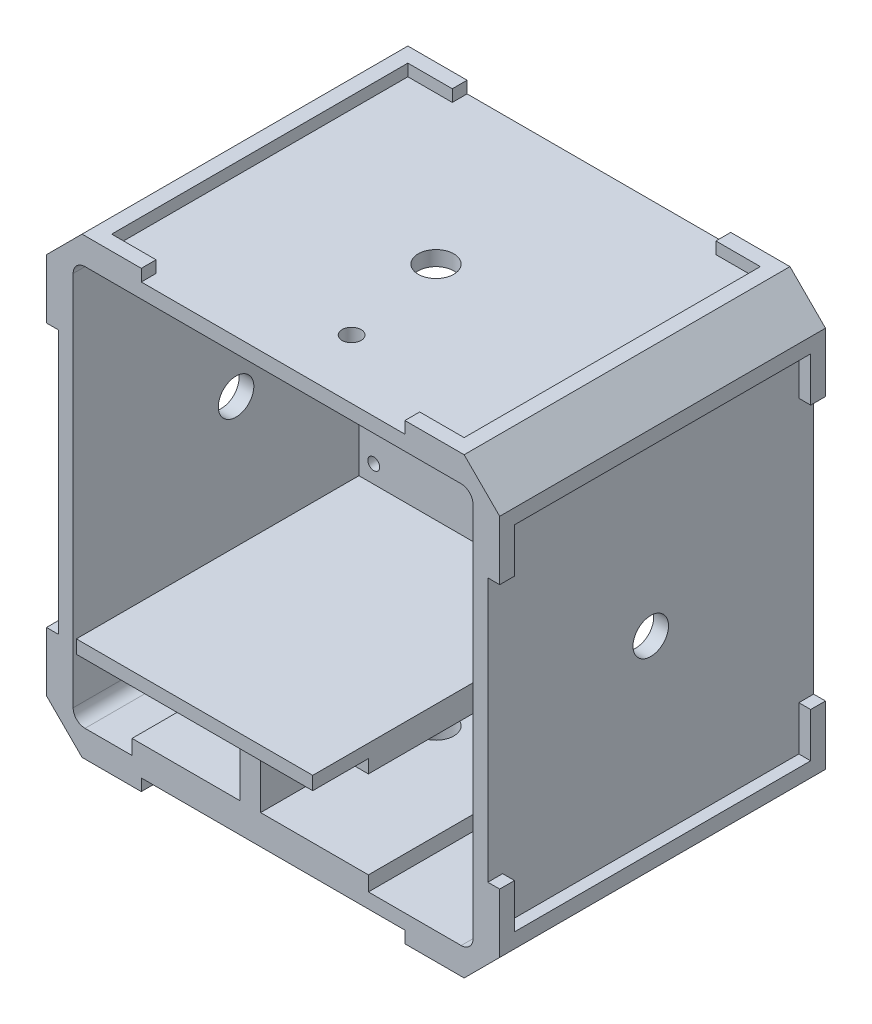
from build123d import *

# Parameters (mm, degrees)
BOSS_EXTRUDE1_DEPTH            = 55
SKETCH2_W                      = 67.5
SKETCH2_H                      = 67.5
BOSS_EXTRUDE2_DEPTH            = 2.5
CUT_EXTRUDE1_REACH             = 75.378
SKETCH3_W                      = 16.5
SKETCH3_H                      = 7
SKETCH3_W_2                    = 8
SKETCH3_H_2                    = 16
FILLET1_R                      = 1
CUT_EXTRUDE2_REACH             = 77.187
SKETCH4_R                      = 1.5
MIRROR2_COPY_1_REACH           = 77.187
MIRROR2_COPY_1_SKETCH_R        = 1.5
BOSS_EXTRUDE3_DEPTH            = 16.09
BOSS_EXTRUDE3_DEPTH_BACK       = 23.81
BOSS_EXTRUDE4_DEPTH            = 47
SKETCH7_W                      = 39.9
SKETCH7_H                      = 19.5
CUT_EXTRUDE3_DEPTH             = 9.4
BOSS_EXTRUDE7_DEPTH            = 2
CUT_EXTRUDE6_REACH             = 85.213
CUT_EXTRUDE6_DIRECTION_2_DEPTH = 84.213490493
CUT_EXTRUDE8_DEPTH             = 104.526192338
CUT_EXTRUDE8_DEPTH_BACK        = 2.5
SKETCH15_R                     = 1.6
SKETCH16_W                     = 7.5
SKETCH16_H                     = 2.5
BOSS_EXTRUDE8_DEPTH            = 7
CUT_EXTRUDE9_REACH             = 74.438
SKETCH17_R                     = 1
SKETCH19_R                     = 3
CUT_EXTRUDE10_DEPTH            = 2.5
BOSS_EXTRUDE9_DEPTH            = 2
CIRPATTERN1_COUNT              = 4
CIRPATTERN2_COUNT              = 4
CUT_EXTRUDE11_DEPTH            = 2.5
BOSS_EXTRUDE12_DEPTH           = 55
CUT_EXTRUDE12_REACH            = 75.459
SKETCH23_W                     = 5.5
SKETCH23_H                     = 16
BOSS_EXTRUDE13_REACH           = 94.538
FILLET2_R                      = 1.5


with BuildPart() as part:
    # Sketch1 → Boss-Extrude1 (new body)
    with BuildSketch(Plane.XY):
        with BuildLine():
            Line((-36.25, 32.25), (-36.25, -32.25))
            ThreePointArc((-36.25, -32.25), (-35.078427125, -35.078427125), (-32.25, -36.25))
            Line((-32.25, -36.25), (32.25, -36.25))
            ThreePointArc((32.25, -36.25), (35.078427125, -35.078427125), (36.25, -32.25))
            Line((36.25, -32.25), (36.25, 32.25))
            ThreePointArc((36.25, 32.25), (35.078427125, 35.078427125), (32.25, 36.25))
            Line((32.25, 36.25), (-32.25, 36.25))
            ThreePointArc((-32.25, 36.25), (-35.078427125, 35.078427125), (-36.25, 32.25))
        make_face()
        with BuildLine():
            Line((-31.75, 33.75), (31.75, 33.75))
            ThreePointArc((31.75, 33.75), (33.164213562, 33.164213562), (33.75, 31.75))
            Line((33.75, 31.75), (33.75, -31.75))
            ThreePointArc((33.75, -31.75), (33.164213562, -33.164213562), (31.75, -33.75))
            Line((31.75, -33.75), (-31.75, -33.75))
            ThreePointArc((-31.75, -33.75), (-33.164213562, -33.164213562), (-33.75, -31.75))
            Line((-33.75, -31.75), (-33.75, 31.75))
            ThreePointArc((-33.75, 31.75), (-33.164213562, 33.164213562), (-31.75, 33.75))
        make_face(mode=Mode.SUBTRACT)
    extrude(amount=BOSS_EXTRUDE1_DEPTH)

    # Sketch2 → Boss-Extrude2 (add)
    with BuildSketch(Plane.XY):
        Rectangle(SKETCH2_W, SKETCH2_H)
    extrude(amount=BOSS_EXTRUDE2_DEPTH)

    # Sketch3 → Cut-Extrude1 (cut, up to next)
    with BuildSketch(Plane.XY.offset(2.5), mode=Mode.PRIVATE) as cut_extrude1_sk1:
        with Locations((-11.63, 14.79)):
            Rectangle(SKETCH3_W, SKETCH3_H)
    cut_extrude1_tool1 = extrude(cut_extrude1_sk1.sketch, amount=-CUT_EXTRUDE1_REACH, mode=Mode.PRIVATE) & part.part
    # Sketch3 → Cut-Extrude1 (cut, up to next)
    with BuildSketch(Plane.XY.offset(2.5), mode=Mode.PRIVATE) as cut_extrude1_sk2:
        Rectangle(SKETCH3_W_2, SKETCH3_H_2)
    cut_extrude1_tool2 = extrude(cut_extrude1_sk2.sketch, amount=-CUT_EXTRUDE1_REACH, mode=Mode.PRIVATE) & part.part
    add(cut_extrude1_tool1.solids().sort_by_distance((-11.63, 14.79, 2.5))[0], mode=Mode.SUBTRACT)
    add(cut_extrude1_tool2.solids().sort_by_distance((0, 0, 2.5))[0], mode=Mode.SUBTRACT)

    # Fillet1
    fillet1_edges = [part.edges().sort_by_distance(p)[0] for p in [
        (-19.88, 11.29, 1.25),
        (-19.88, 18.29, 1.25),
        (-3.38, 18.29, 1.25),
        (-3.38, 11.29, 1.25),
        (4, -8, 1.25),
        (-4, -8, 1.25),
        (-4, 8, 1.25),
        (4, 8, 1.25),
    ]]
    fillet(fillet1_edges, radius=FILLET1_R)

    # Sketch4 → Cut-Extrude2 (cut, up to next)
    with BuildSketch(Plane(origin=(0, 0, 0), x_dir=(-1, 0, 0), z_dir=(0, 0, -1)), mode=Mode.PRIVATE) as cut_extrude2_sk1:
        with Locations((-28.75, 28.75)):
            Circle(SKETCH4_R)
    cut_extrude2_tool1 = extrude(cut_extrude2_sk1.sketch, amount=-CUT_EXTRUDE2_REACH, mode=Mode.PRIVATE) & part.part
    cut_extrude2 = cut_extrude2_tool1.solids().sort_by_distance((28.75, 28.75, 0))[0]
    add(cut_extrude2, mode=Mode.SUBTRACT)

    # Mirror1: Cut-Extrude2 across plane
    add(cut_extrude2.mirror(Plane(origin=(0, 0, 0), x_dir=(0, 0, 1), z_dir=(1, 0, 0))), mode=Mode.SUBTRACT)

    # Mirror2: Cut-Extrude2 across plane
    add(cut_extrude2.mirror(Plane.ZX), mode=Mode.SUBTRACT)

    # Mirror2 copy 1 sketch → Mirror2 copy 1 (cut, up to next)
    with BuildSketch(Plane(origin=(0, 0, 0), x_dir=(1, 0, 0), z_dir=(0, 0, -1)), mode=Mode.PRIVATE) as mirror2_copy_1_sk1:
        with Locations((-28.75, 28.75)):
            Circle(MIRROR2_COPY_1_SKETCH_R)
    mirror2_copy_1_tool1 = extrude(mirror2_copy_1_sk1.sketch, amount=-MIRROR2_COPY_1_REACH, mode=Mode.PRIVATE) & part.part
    add(mirror2_copy_1_tool1.solids().sort_by_distance((-28.75, -28.75, 0))[0], mode=Mode.SUBTRACT)



with BuildPart() as body_2:
    # Sketch5 → Boss-Extrude3 (new, two sides: drawn at the far end of the back side and taken through both)
    with BuildSketch(Plane(origin=(0, 0, 0), x_dir=(0, 0, -1), z_dir=(1, 0, 0)).offset(-BOSS_EXTRUDE3_DEPTH_BACK)):
        Polygon((-16.7, 12), (-16.7, -12), (-62.4, -12), (-64.4, -12), (-64.4, -14), (-14.7, -14), (-14.7, 12), align=None)
    extrude(amount=BOSS_EXTRUDE3_DEPTH + BOSS_EXTRUDE3_DEPTH_BACK)


with BuildPart() as part_1:
    add(part.part)

    add(body_2.part)  # Boss-Extrude4 merges body 2
    # Sketch6 → Boss-Extrude4 (add)
    with BuildSketch(Plane.XY.offset(64.4)):
        Polygon((-23.81, -14), (16.09, -14), (16.09, -16.5), (-2.11, -16.5), (-2.11, -31.25), (16.09, -31.25), (16.09, -33.75), (-23.81, -33.75), (-23.81, -31.25), (-5.61, -31.25), (-5.61, -16.5), (-23.81, -16.5), align=None)
    extrude(amount=-BOSS_EXTRUDE4_DEPTH)

    # Sketch7 → Cut-Extrude3 (cut)
    with BuildSketch(Plane.XY.offset(64.4)):
        with Locations((-3.86, -24)):
            Rectangle(SKETCH7_W, SKETCH7_H)
    extrude(amount=-CUT_EXTRUDE3_DEPTH, mode=Mode.SUBTRACT)

    # Sketch12 → Boss-Extrude7 (add)
    with BuildSketch(Plane(origin=(0, 36.25, 0), x_dir=(1, 0, 0), z_dir=(0, 1, 0))):
        Polygon((29.75, -55), (32.25, -55), (32.25, -52.5), (32.25, -45), (29.75, -45), (29.75, -52.5), (22.25, -52.5), (22.25, -55), align=None)
        Polygon((-32.25, 0), (-32.25, -10), (-29.75, -10), (-29.75, -2.5), (-22.25, -2.5), (-22.25, 0), align=None)
    boss_extrude7 = extrude(amount=BOSS_EXTRUDE7_DEPTH)

    # Sketch13 → Cut-Extrude6 (cut, up to next)
    with BuildSketch(Plane(origin=(0, 0, 0), x_dir=(-1, 0, 0), z_dir=(0, 0, -1)), mode=Mode.PRIVATE) as cut_extrude6_sk1:
        with BuildLine():
            Line((-33.75, 21.25), (-25.25, 21.25))
            ThreePointArc((-25.25, 21.25), (-22.421572875, 22.421572875), (-21.25, 25.25))
            Line((-21.25, 25.25), (-21.25, 33.75))
            Line((-21.25, 33.75), (21.25, 33.75))
            Line((21.25, 33.75), (21.25, 25.25))
            ThreePointArc((21.25, 25.25), (22.421572875, 22.421572875), (25.25, 21.25))
            Line((25.25, 21.25), (33.75, 21.25))
            Line((33.75, 21.25), (33.75, -21.25))
            Line((33.75, -21.25), (25.25, -21.25))
            ThreePointArc((25.25, -21.25), (22.421572875, -22.421572875), (21.25, -25.25))
            Line((21.25, -25.25), (21.25, -33.75))
            Line((21.25, -33.75), (-21.25, -33.75))
            Line((-21.25, -33.75), (-21.25, -25.25))
            ThreePointArc((-21.25, -25.25), (-22.421572875, -22.421572875), (-25.25, -21.25))
            Line((-25.25, -21.25), (-33.75, -21.25))
            Line((-33.75, -21.25), (-33.75, 21.25))
        make_face()
    cut_extrude6_tool1 = extrude(cut_extrude6_sk1.sketch, amount=-CUT_EXTRUDE6_REACH, mode=Mode.PRIVATE) & part_1.part
    add(cut_extrude6_tool1.solids().sort_by_distance((0, 0, 0))[0], mode=Mode.SUBTRACT)

    # Sketch13 → Cut-Extrude6 direction 2 (cut)
    with BuildSketch(Plane(origin=(0, 0, 0), x_dir=(-1, 0, 0), z_dir=(0, 0, -1))):
        with BuildLine():
            Line((-33.75, 21.25), (-25.25, 21.25))
            ThreePointArc((-25.25, 21.25), (-22.421572875, 22.421572875), (-21.25, 25.25))
            Line((-21.25, 25.25), (-21.25, 33.75))
            Line((-21.25, 33.75), (21.25, 33.75))
            Line((21.25, 33.75), (21.25, 25.25))
            ThreePointArc((21.25, 25.25), (22.421572875, 22.421572875), (25.25, 21.25))
            Line((25.25, 21.25), (33.75, 21.25))
            Line((33.75, 21.25), (33.75, -21.25))
            Line((33.75, -21.25), (25.25, -21.25))
            ThreePointArc((25.25, -21.25), (22.421572875, -22.421572875), (21.25, -25.25))
            Line((21.25, -25.25), (21.25, -33.75))
            Line((21.25, -33.75), (-21.25, -33.75))
            Line((-21.25, -33.75), (-21.25, -25.25))
            ThreePointArc((-21.25, -25.25), (-22.421572875, -22.421572875), (-25.25, -21.25))
            Line((-25.25, -21.25), (-33.75, -21.25))
            Line((-33.75, -21.25), (-33.75, 21.25))
        make_face()
    extrude(amount=CUT_EXTRUDE6_DIRECTION_2_DEPTH, mode=Mode.SUBTRACT)

    # Sketch15 → Cut-Extrude8 (cut, two sides: drawn at the far end of the back side and taken through both)
    with BuildSketch(Plane(origin=(0, 36.25, 0), x_dir=(1, 0, 0), z_dir=(0, 1, 0)).offset(-CUT_EXTRUDE8_DEPTH_BACK)):
        with Locations(Location((3.25, -45, 0), (0, 0, 90))):
            Circle(SKETCH15_R)
    extrude(amount=CUT_EXTRUDE8_DEPTH + CUT_EXTRUDE8_DEPTH_BACK, mode=Mode.SUBTRACT)

    # Sketch16 → Boss-Extrude8 (add)
    with BuildSketch(Plane(origin=(-33.75, 0, 0), x_dir=(0, 0, -1), z_dir=(1, 0, 0))):
        with Locations((-12.25, 30.9)):
            Rectangle(SKETCH16_W, SKETCH16_H)
    extrude(amount=BOSS_EXTRUDE8_DEPTH)

    # Sketch17 → Cut-Extrude9 (cut, up to next)
    with BuildSketch(Plane(origin=(0, 0, 14.7), x_dir=(-1, 0, 0), z_dir=(0, 0, -1)), mode=Mode.PRIVATE) as cut_extrude9_sk1:
        with Locations(Location((-13.59, 9, 0), (0, 0, 90))):
            Circle(SKETCH17_R)
    cut_extrude9_tool1 = extrude(cut_extrude9_sk1.sketch, amount=-CUT_EXTRUDE9_REACH, mode=Mode.PRIVATE) & part_1.part
    # Sketch17 → Cut-Extrude9 (cut, up to next)
    with BuildSketch(Plane(origin=(0, 0, 14.7), x_dir=(-1, 0, 0), z_dir=(0, 0, -1)), mode=Mode.PRIVATE) as cut_extrude9_sk2:
        with Locations(Location((-13.59, -9, 0), (0, 0, 90))):
            Circle(SKETCH17_R)
    cut_extrude9_tool2 = extrude(cut_extrude9_sk2.sketch, amount=-CUT_EXTRUDE9_REACH, mode=Mode.PRIVATE) & part_1.part
    # Sketch17 → Cut-Extrude9 (cut, up to next)
    with BuildSketch(Plane(origin=(0, 0, 14.7), x_dir=(-1, 0, 0), z_dir=(0, 0, -1)), mode=Mode.PRIVATE) as cut_extrude9_sk3:
        with Locations(Location((21.31, -9, 0), (0, 0, 90))):
            Circle(SKETCH17_R)
    cut_extrude9_tool3 = extrude(cut_extrude9_sk3.sketch, amount=-CUT_EXTRUDE9_REACH, mode=Mode.PRIVATE) & part_1.part
    add(cut_extrude9_tool1.solids().sort_by_distance((13.59, 9, 14.7))[0], mode=Mode.SUBTRACT)
    add(cut_extrude9_tool2.solids().sort_by_distance((13.59, -9, 14.7))[0], mode=Mode.SUBTRACT)
    add(cut_extrude9_tool3.solids().sort_by_distance((-21.31, -9, 14.7))[0], mode=Mode.SUBTRACT)

    # Sketch19 → Cut-Extrude10 (cut)
    with BuildSketch(Plane(origin=(0, 36.25, 0), x_dir=(1, 0, 0), z_dir=(0, 1, 0))):
        with Locations(Location((0, -27.5, 0), (0, 0, 270))):
            Circle(SKETCH19_R)
    cut_extrude10 = extrude(amount=-CUT_EXTRUDE10_DEPTH, mode=Mode.SUBTRACT)

    # Sketch20 → Boss-Extrude9 (add)
    with BuildSketch(Plane(origin=(36.25, 0, -36.25), x_dir=(0, 0, 1), z_dir=(-1, 0, 0))):
        Polygon((91.25, 32.25), (81.25, 32.25), (81.25, 29.75), (88.75, 29.75), (88.75, 22.25), (91.25, 22.25), align=None)
        Polygon((36.25, -22.25), (36.25, -32.25), (46.25, -32.25), (46.25, -29.75), (38.75, -29.75), (38.75, -22.25), align=None)
    boss_extrude9 = extrude(amount=-BOSS_EXTRUDE9_DEPTH)

    # CirPattern1: Boss-Extrude7, Cut-Extrude10 ×4 about axis
    cirpattern1_axis = Axis((0, 0, 0), (0, 0, 1))
    add([boss_extrude7.rotate(cirpattern1_axis, i * 360 / CIRPATTERN1_COUNT) for i in range(1, CIRPATTERN1_COUNT)])
    add([cut_extrude10.rotate(cirpattern1_axis, i * 360 / CIRPATTERN1_COUNT) for i in range(1, CIRPATTERN1_COUNT)], mode=Mode.SUBTRACT)

    # CirPattern2: Boss-Extrude9 ×4 about axis
    cirpattern2_axis = Axis((0, 0, 0), (0, 0, 1))
    for i in range(1, CIRPATTERN2_COUNT):
        add(boss_extrude9.rotate(cirpattern2_axis, i * 360 / CIRPATTERN2_COUNT))

    # Sketch21 → Cut-Extrude11 (cut)
    with BuildSketch(Plane.XZ.offset(33.75)):
        with BuildLine():
            Line((-2.11, 25.367419404), (-2.11, 29.632580596))
            ThreePointArc((-2.11, 29.632580596), (3, 27.5), (-2.11, 25.367419404))
        make_face()
    extrude(amount=-CUT_EXTRUDE11_DEPTH, mode=Mode.SUBTRACT)

    # Sketch22 → Boss-Extrude12 (add, through all)
    with BuildSketch(Plane.XY.offset(55)):
        Polygon((-38.25, 32.25), (-32.25, 38.25), (-29.75, 38.25), (-29.75, 33.75), (-33.75, 33.75), (-33.75, 29.75), (-38.25, 29.75), align=None)
        Polygon((33.75, 33.75), (33.75, 29.75), (38.25, 29.75), (38.25, 32.25), (32.25, 38.25), (29.75, 38.25), (29.75, 33.75), align=None)
        Polygon((38.25, -32.25), (32.25, -38.25), (29.75, -38.25), (29.75, -33.75), (33.75, -33.75), (33.75, -29.75), (38.25, -29.75), align=None)
        Polygon((-33.75, -33.75), (-33.75, -29.75), (-38.25, -29.75), (-38.25, -32.25), (-32.25, -38.25), (-29.75, -38.25), (-29.75, -33.75), align=None)
    extrude(amount=-BOSS_EXTRUDE12_DEPTH)

    # Sketch23 → Cut-Extrude12 (cut, up to next)
    with BuildSketch(Plane(origin=(0, 0, 14.7), x_dir=(-1, 0, 0), z_dir=(0, 0, -1)), mode=Mode.PRIVATE) as cut_extrude12_sk1:
        with Locations((21.06, 4)):
            Rectangle(SKETCH23_W, SKETCH23_H)
    cut_extrude12_tool1 = extrude(cut_extrude12_sk1.sketch, amount=-CUT_EXTRUDE12_REACH, mode=Mode.PRIVATE) & part_1.part
    add(cut_extrude12_tool1.solids().sort_by_distance((-21.06, 4, 14.7))[0], mode=Mode.SUBTRACT)

    # Boss-Extrude13: up to this face of the body (flat: up to its plane)
    boss_extrude13_end = Plane(part_1.part.faces().sort_by_distance((-23.81, -13.63350059, 36.484368359))[0])
    # Sketch24 → Boss-Extrude13 (add, up to the picked face)
    with BuildSketch(Plane(origin=(16.09, 0, 0), x_dir=(0, 0, -1), z_dir=(1, 0, 0)), mode=Mode.PRIVATE) as boss_extrude13_sk1:
        with BuildLine():
            Line((-17.4, -16.5), (-17.4, -13.792))
            Line((-17.4, -13.792), (-14.7, -14))
            ThreePointArc((-14.7, -14), (-15.560163051, -15.779023905), (-17.4, -16.5))
        make_face()
    boss_extrude13_tool1 = split(extrude(boss_extrude13_sk1.sketch, amount=-BOSS_EXTRUDE13_REACH, mode=Mode.PRIVATE), bisect_by=boss_extrude13_end, keep=Keep.BOTH, mode=Mode.PRIVATE)
    add(boss_extrude13_tool1.solids().sort_by(Axis((16.09, -14.996891, 16.28436), (-1, 0, 0)))[0])

    # Fillet2
    fillet2_edges = [part_1.edges().sort_by_distance(p)[0] for p in [
        (16.09, 12, 15.7),
    ]]
    fillet(fillet2_edges, radius=FILLET2_R)


solid = part_1.part
